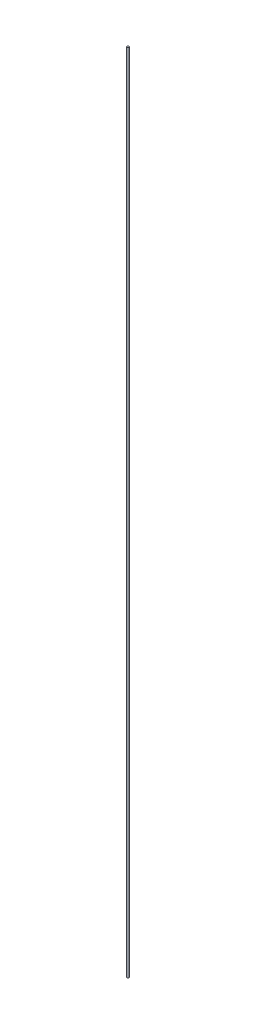
from build123d import *

# Parameters (mm, degrees)
SKETCH1_R           = 0.025
BOSS_EXTRUDE1_DEPTH = 20


with BuildPart() as part:
    # Sketch1 → Boss-Extrude1 (new body)
    with BuildSketch(Plane(origin=(0, 0, 0), x_dir=(1, 0, 0), z_dir=(0, 1, 0))):
        with Locations(Location((0, 0, 0), (0, 0, 270))):
            Circle(SKETCH1_R)
    extrude(amount=BOSS_EXTRUDE1_DEPTH)


solid = part.part
